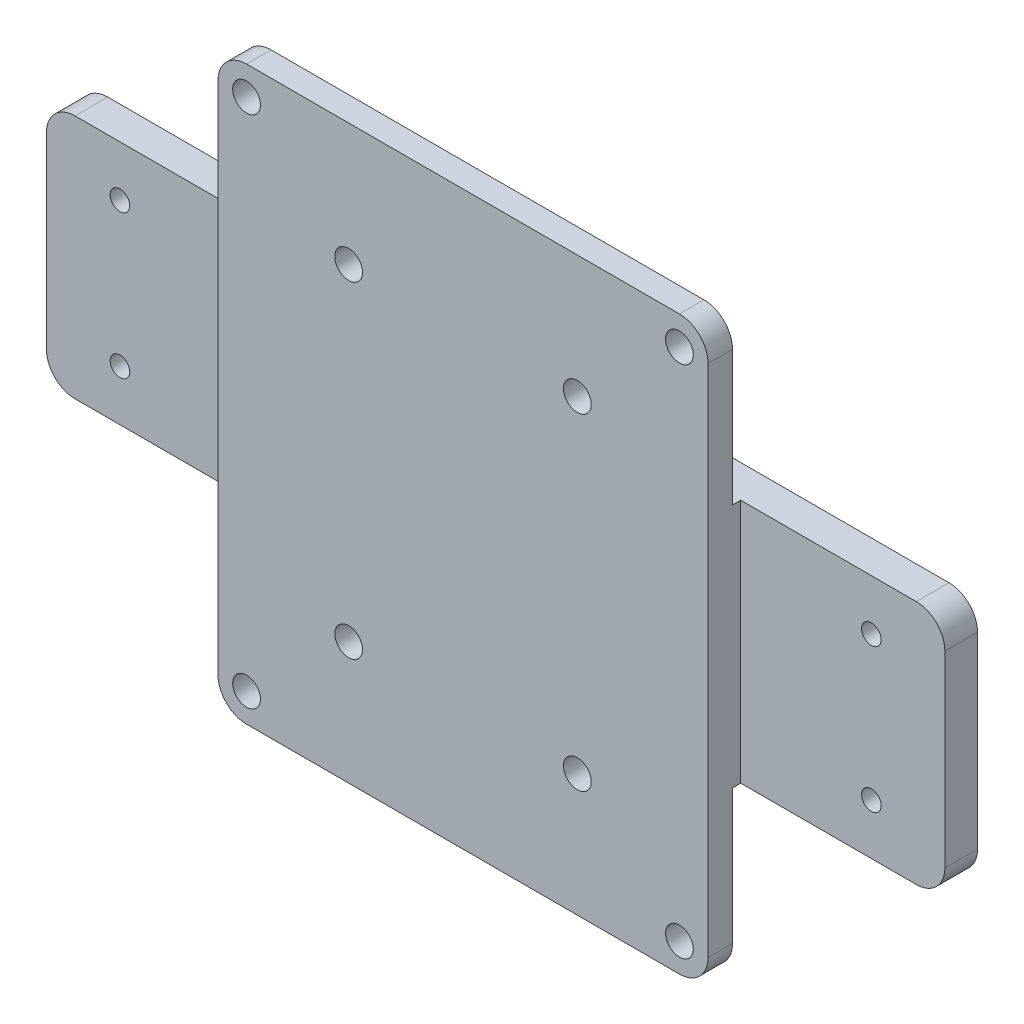
from build123d import *

# Parameters (mm, degrees)
SKETCH2_R           = 1.7
BOSS_EXTRUDE2_DEPTH = 3
SKETCH3_W           = 30
SKETCH3_H           = 5
BOSS_EXTRUDE3_DEPTH = 5
SKETCH4_W           = 30
SKETCH4_H           = 5
BOSS_EXTRUDE4_DEPTH = 5
SKETCH5_W           = 30
SKETCH5_H           = 4
BOSS_EXTRUDE5_DEPTH = 25
SKETCH6_W           = 30
SKETCH6_H           = 4
BOSS_EXTRUDE8_DEPTH = 25
SKETCH8_R           = 1.2
CUT_EXTRUDE1_DEPTH  = 25
FILLET5_R           = 3.5
FILLET6_R           = 3.5
FILLET7_R           = 3.5
FILLET8_R           = 3.5


with BuildPart() as part:
    # Sketch2 → Boss-Extrude2 (new body)
    with BuildSketch(Plane(origin=(0, 0, 0), x_dir=(0, 1, 0), z_dir=(0, 0, 1))):
        with BuildLine():
            Line((-31.5, -30), (31.5, -30))
            ThreePointArc((31.5, -30), (33.974873734, -28.974873734), (35, -26.5))
            Line((35, -26.5), (35, 26.5))
            ThreePointArc((35, 26.5), (33.974873734, 28.974873734), (31.5, 30))
            Line((31.5, 30), (-31.5, 30))
            ThreePointArc((-31.5, 30), (-33.974873734, 28.974873734), (-35, 26.5))
            Line((-35, 26.5), (-35, -26.5))
            ThreePointArc((-35, -26.5), (-33.974873734, -28.974873734), (-31.5, -30))
        make_face()
        with Locations(Location((20, -14, 0), (0, 0, 270))):
            Circle(SKETCH2_R, mode=Mode.SUBTRACT)
        with Locations(Location((-20, -14, 0), (0, 0, 270))):
            Circle(SKETCH2_R, mode=Mode.SUBTRACT)
        with Locations(Location((20, 14, 0), (0, 0, 270))):
            Circle(SKETCH2_R, mode=Mode.SUBTRACT)
        with Locations(Location((-20, 14, 0), (0, 0, 270))):
            Circle(SKETCH2_R, mode=Mode.SUBTRACT)
        with Locations(Location((31.5, -26.5, 0), (0, 0, 270))):
            Circle(SKETCH2_R, mode=Mode.SUBTRACT)
        with Locations(Location((-31.5, -26.5, 0), (0, 0, 270))):
            Circle(SKETCH2_R, mode=Mode.SUBTRACT)
        with Locations(Location((31.5, 26.5, 0), (0, 0, 270))):
            Circle(SKETCH2_R, mode=Mode.SUBTRACT)
        with Locations(Location((-31.5, 26.5, 0), (0, 0, 270))):
            Circle(SKETCH2_R, mode=Mode.SUBTRACT)
    extrude(amount=BOSS_EXTRUDE2_DEPTH)

    # Sketch3 → Boss-Extrude3 (add)
    with BuildSketch(Plane.YZ.offset(30)):
        with Locations((0, -2.5)):
            Rectangle(SKETCH3_W, SKETCH3_H)
    extrude(amount=-BOSS_EXTRUDE3_DEPTH)

    # Sketch4 → Boss-Extrude4 (add)
    with BuildSketch(Plane(origin=(-30, 0, 0), x_dir=(0, -1, 0), z_dir=(-1, 0, 0))):
        with Locations((0, -2.5)):
            Rectangle(SKETCH4_W, SKETCH4_H)
    extrude(amount=-BOSS_EXTRUDE4_DEPTH)

    # Sketch5 → Boss-Extrude5 (add)
    with BuildSketch(Plane(origin=(-30, 0, 0), x_dir=(0, -1, 0), z_dir=(-1, 0, 0))):
        with Locations((0, -3)):
            Rectangle(SKETCH5_W, SKETCH5_H)
    extrude(amount=BOSS_EXTRUDE5_DEPTH)

    # Sketch6 → Boss-Extrude8 (add)
    with BuildSketch(Plane.YZ.offset(30)):
        with Locations((0, -3)):
            Rectangle(SKETCH6_W, SKETCH6_H)
    extrude(amount=BOSS_EXTRUDE8_DEPTH)

    # Sketch8 → Cut-Extrude1 (cut)
    with BuildSketch(Plane(origin=(0, 0, -1), x_dir=(0, -1, 0), z_dir=(0, 0, 1))):
        with Locations(Location((-8.8, -46, 0), (0, 0, 90))):
            Circle(SKETCH8_R)
        with Locations(Location((8.8, -46, 0), (0, 0, 90))):
            Circle(SKETCH8_R)
        with Locations(Location((-8.8, 46, 0), (0, 0, 90))):
            Circle(SKETCH8_R)
        with Locations(Location((8.8, 46, 0), (0, 0, 90))):
            Circle(SKETCH8_R)
    extrude(amount=-CUT_EXTRUDE1_DEPTH, mode=Mode.SUBTRACT)

    # Fillet5
    fillet5_edges = [part.edges().sort_by_distance(p)[0] for p in [
        (-55, -15, -3),
    ]]
    fillet(fillet5_edges, radius=FILLET5_R)

    # Fillet6
    fillet6_edges = [part.edges().sort_by_distance(p)[0] for p in [
        (-55, 15, -3),
    ]]
    fillet(fillet6_edges, radius=FILLET6_R)

    # Fillet7
    fillet7_edges = [part.edges().sort_by_distance(p)[0] for p in [
        (55, 15, -3),
    ]]
    fillet(fillet7_edges, radius=FILLET7_R)

    # Fillet8
    fillet8_edges = [part.edges().sort_by_distance(p)[0] for p in [
        (55, -15, -3),
    ]]
    fillet(fillet8_edges, radius=FILLET8_R)


solid = part.part
